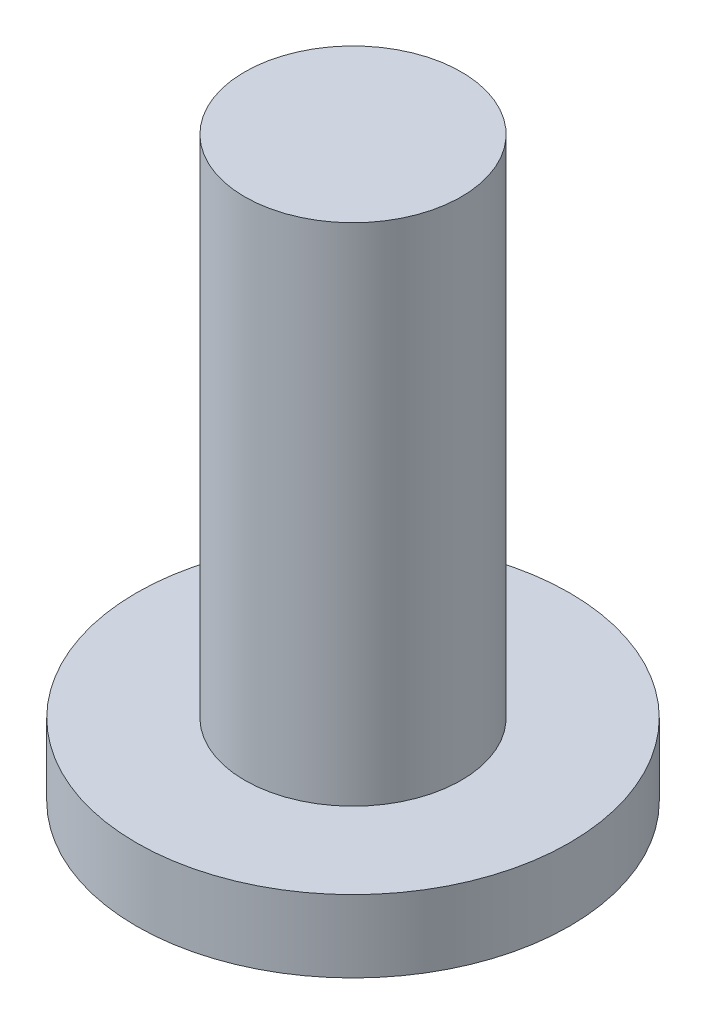
from build123d import *

# Parameters (mm, degrees)
SKETCH_1_R      = 150
EXTRUDE_1_DEPTH = 50
SKETCH_2_R      = 75
EXTRUDE_2_DEPTH = 350


with BuildPart() as part:
    # 草图1 → 凸台-拉伸1 (new body)
    with BuildSketch(Plane(origin=(0, 0, 0), x_dir=(1, 0, 0), z_dir=(0, 1, 0))):
        with Locations(Location((0, 0, 0), (0, 0, 270))):
            Circle(SKETCH_1_R)
    extrude(amount=EXTRUDE_1_DEPTH)

    # 草图2 → 凸台-拉伸2 (add)
    with BuildSketch(Plane(origin=(0, 50, 0), x_dir=(1, 0, 0), z_dir=(0, 1, 0))):
        with Locations(Location((0, 0, 0), (0, 0, 270))):
            Circle(SKETCH_2_R)
    extrude(amount=EXTRUDE_2_DEPTH)


solid = part.part
